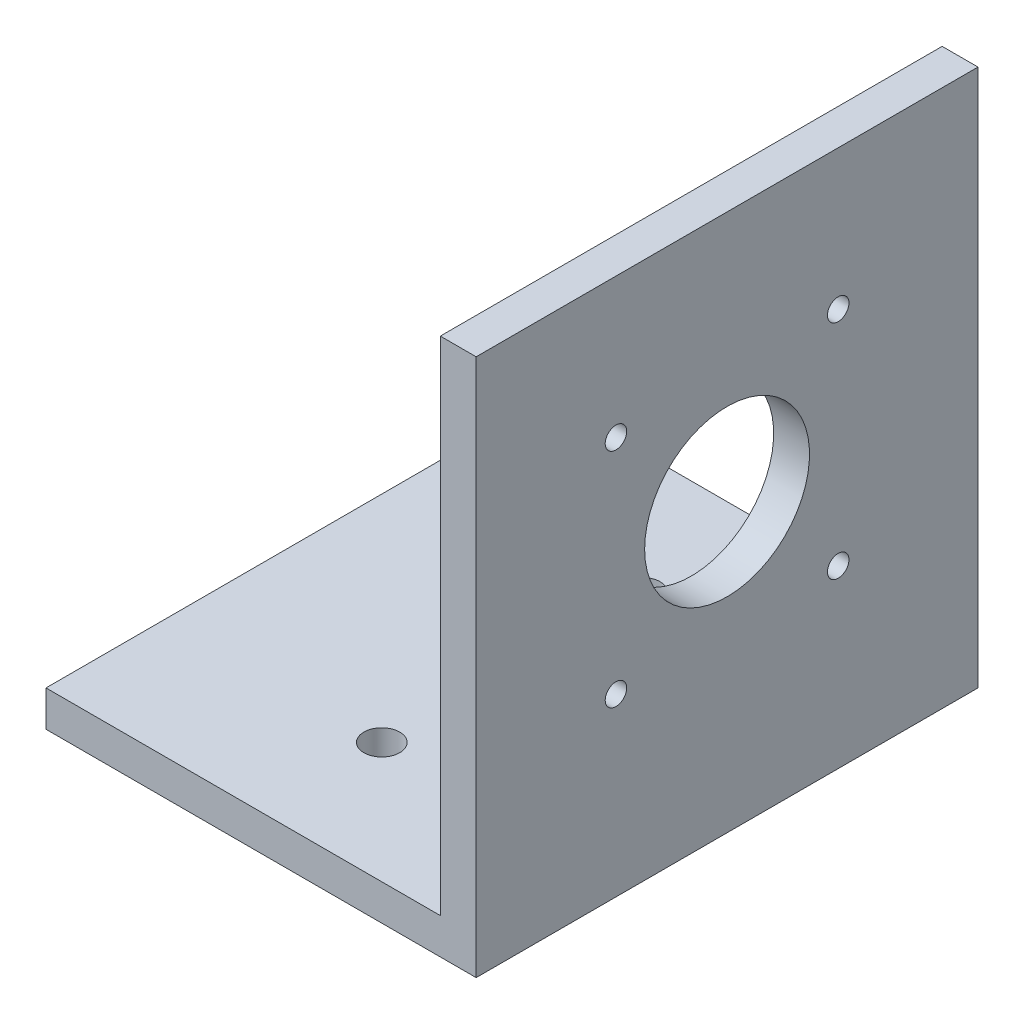
from build123d import *

# Parameters (mm, degrees)
SKETCH1_W           = 60
SKETCH1_H           = 70
BOSS_EXTRUDE1_DEPTH = 5
SKETCH2_W           = 5
SKETCH2_H           = 70
BOSS_EXTRUDE2_DEPTH = 70
SKETCH3_R           = 2.5
CUT_EXTRUDE1_DEPTH  = 70
SKETCH4_R           = 11.5
CUT_EXTRUDE2_DEPTH  = 10
SKETCH5_R           = 1.5
CUT_EXTRUDE3_DEPTH  = 10


with BuildPart() as part:
    # Sketch1 → Boss-Extrude1 (new body)
    with BuildSketch(Plane(origin=(0, 0, 0), x_dir=(1, 0, 0), z_dir=(0, 1, 0))):
        Rectangle(SKETCH1_W, SKETCH1_H)
    extrude(amount=BOSS_EXTRUDE1_DEPTH)

    # Sketch2 → Boss-Extrude2 (add)
    with BuildSketch(Plane(origin=(0, 5, 0), x_dir=(1, 0, 0), z_dir=(0, 1, 0))):
        with Locations((27.5, 0)):
            Rectangle(SKETCH2_W, SKETCH2_H)
    extrude(amount=BOSS_EXTRUDE2_DEPTH)

    # Sketch3 → Cut-Extrude1 (cut)
    with BuildSketch(Plane(origin=(0, 5, 0), x_dir=(1, 0, 0), z_dir=(0, 1, 0))):
        with Locations(Location((0, 18.161512971, 0), (0, 0, 270))):
            Circle(SKETCH3_R)
        with Locations(Location((0, -18.161512971, 0), (0, 0, 90))):
            Circle(SKETCH3_R)
    extrude(amount=-CUT_EXTRUDE1_DEPTH, mode=Mode.SUBTRACT)

    # Sketch4 → Cut-Extrude2 (cut)
    with BuildSketch(Plane.ZY.offset(-25)):
        with Locations((0, 40)):
            Circle(SKETCH4_R)
    extrude(amount=-CUT_EXTRUDE2_DEPTH, mode=Mode.SUBTRACT)

    # Sketch5 → Cut-Extrude3 (cut)
    with BuildSketch(Plane.ZY.offset(-25)):
        with Locations((-15.5, 55.5)):
            Circle(SKETCH5_R)
        with Locations((15.5, 55.5)):
            Circle(SKETCH5_R)
        with Locations((15.5, 24.5)):
            Circle(SKETCH5_R)
        with Locations((-15.5, 24.5)):
            Circle(SKETCH5_R)
    extrude(amount=-CUT_EXTRUDE3_DEPTH, mode=Mode.SUBTRACT)


solid = part.part
